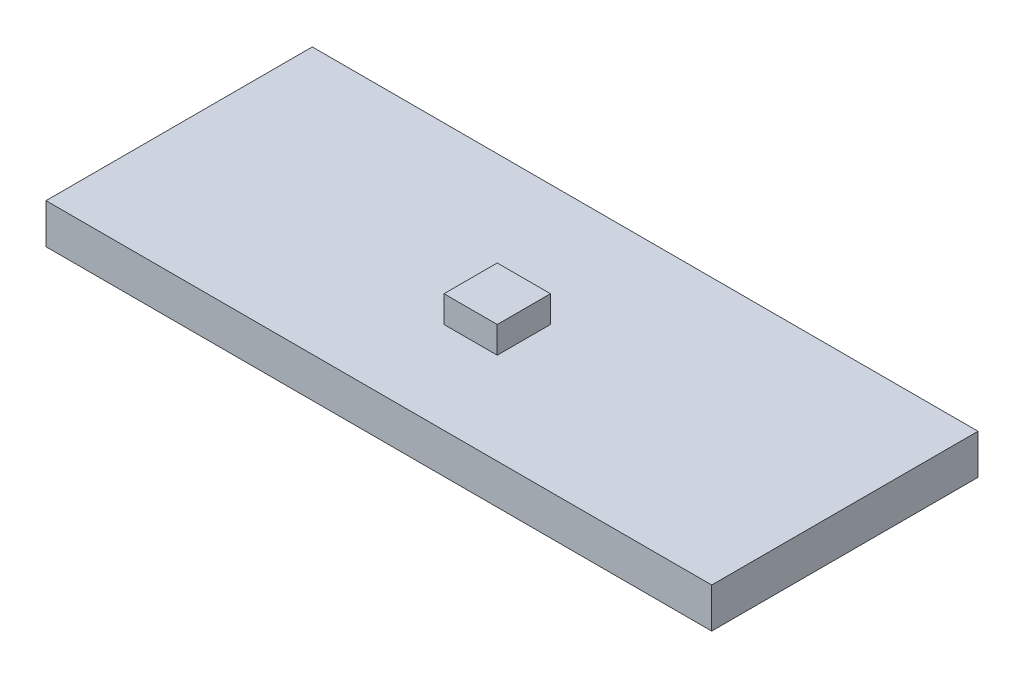
from build123d import *

# Parameters (mm, degrees)
SKETCH2_W           = 25
SKETCH2_H           = 10
BOSS_EXTRUDE1_DEPTH = 1.5
BOSS_EXTRUDE2_DEPTH = 1


with BuildPart() as part:
    # Sketch2 → Boss-Extrude1 (new body)
    with BuildSketch(Plane(origin=(0, 0, 0), x_dir=(1, 0, 0), z_dir=(0, 1, 0))):
        with Locations((12.5, 5)):
            Rectangle(SKETCH2_W, SKETCH2_H)
    extrude(amount=BOSS_EXTRUDE1_DEPTH)

    # Sketch3 → Boss-Extrude2 (add)
    with BuildSketch(Plane(origin=(0, 1.5, 0), x_dir=(1, 0, 0), z_dir=(0, 1, 0))):
        Polygon((12.5, 5.445314902), (13.5, 5.445314902), (13.5, 3.445314902), (11.5, 3.445314902), (11.5, 5.445314902), align=None)
    extrude(amount=BOSS_EXTRUDE2_DEPTH)


solid = part.part
